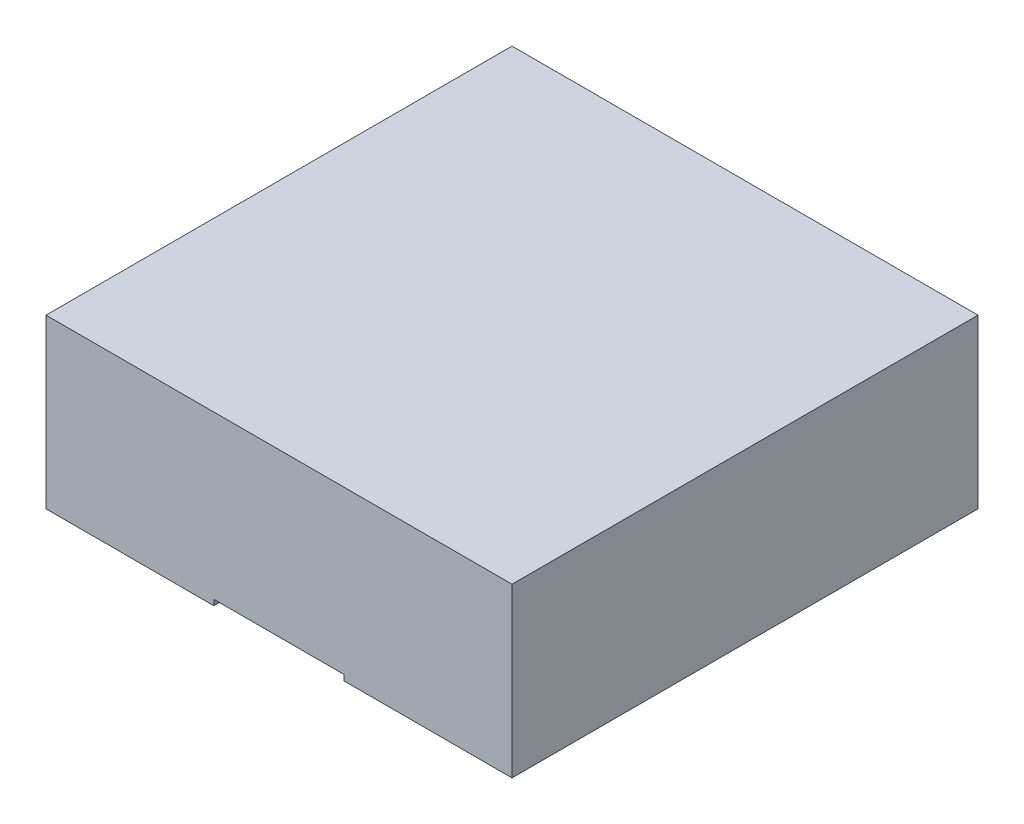
from build123d import *

# Parameters (mm, degrees)
SKETCH1_W           = 25
SKETCH1_H           = 25
BOSS_EXTRUDE1_DEPTH = 4.5
SKETCH2_W           = 7
SKETCH2_H           = 16.5
CUT_EXTRUDE1_DEPTH  = 0.3


with BuildPart() as part:
    # Sketch1 → Boss-Extrude1 (new, symmetric)
    with BuildSketch(Plane(origin=(0, 0, 0), x_dir=(1, 0, 0), z_dir=(0, 1, 0))):
        Rectangle(SKETCH1_W, SKETCH1_H)
    extrude(amount=BOSS_EXTRUDE1_DEPTH, both=True)

    # Sketch2 → Cut-Extrude1 (cut)
    with BuildSketch(Plane.XZ.offset(4.5)):
        with Locations((0, 4.25)):
            Rectangle(SKETCH2_W, SKETCH2_H)
    extrude(amount=-CUT_EXTRUDE1_DEPTH, mode=Mode.SUBTRACT)


solid = part.part
